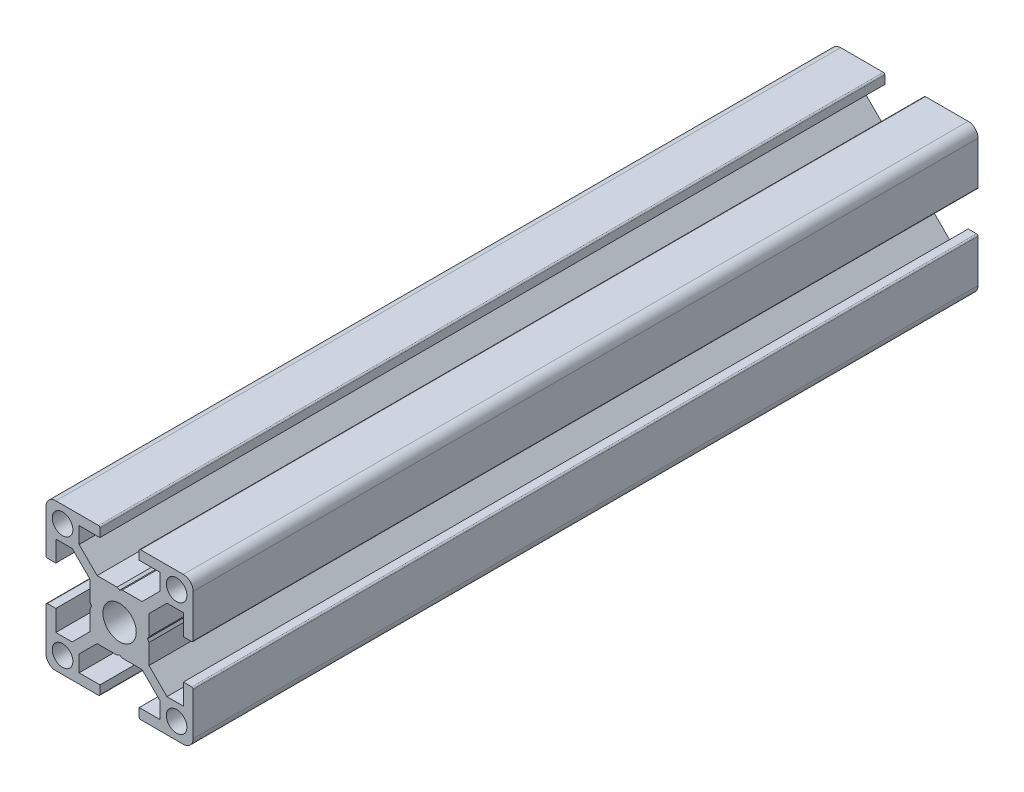
from build123d import *

# Parameters (mm, degrees)
SKETCH1_R           = 2.1
SKETCH1_R_2         = 3.4
BOSS_EXTRUDE1_DEPTH = 160


with BuildPart() as part:
    # Sketch1 → Boss-Extrude1 (new body)
    with BuildSketch(Plane.XY):
        with BuildLine():
            Line((-14.7, 4), (-13, 4))
            Line((-13, 4), (-13, 8.25))
            Line((-13, 8.25), (-9.664213562, 8.25))
            Line((-9.664213562, 8.25), (-6, 4.585786438))
            Line((-6, 4.585786438), (-6, 0.519615242))
            Line((-6, 0.519615242), (-5.7, 0))
            Line((-5.7, 0), (-6, -0.519615242))
            Line((-6, -0.519615242), (-6, -4.585786438))
            Line((-6, -4.585786438), (-9.664213562, -8.25))
            Line((-9.664213562, -8.25), (-13, -8.25))
            Line((-13, -8.25), (-13, -4))
            Line((-13, -4), (-14.7, -4))
            ThreePointArc((-14.7, -4), (-14.912132034, -4.087867966), (-15, -4.3))
            Line((-15, -4.3), (-15, -13))
            ThreePointArc((-15, -13), (-14.414213562, -14.414213562), (-13, -15))
            Line((-13, -15), (-4.3, -15))
            ThreePointArc((-4.3, -15), (-4.087867966, -14.912132034), (-4, -14.7))
            Line((-4, -14.7), (-4, -13))
            Line((-4, -13), (-8.25, -13))
            Line((-8.25, -13), (-8.25, -9.664213562))
            Line((-8.25, -9.664213562), (-4.585786438, -6))
            Line((-4.585786438, -6), (-0.519615242, -6))
            Line((-0.519615242, -6), (0, -5.7))
            Line((0, -5.7), (0.519615242, -6))
            Line((0.519615242, -6), (4.585786438, -6))
            Line((4.585786438, -6), (8.25, -9.664213562))
            Line((8.25, -9.664213562), (8.25, -13))
            Line((8.25, -13), (4, -13))
            Line((4, -13), (4, -14.7))
            ThreePointArc((4, -14.7), (4.087867966, -14.912132034), (4.3, -15))
            Line((4.3, -15), (13, -15))
            ThreePointArc((13, -15), (14.414213562, -14.414213562), (15, -13))
            Line((15, -13), (15, -4.3))
            ThreePointArc((15, -4.3), (14.912132034, -4.087867966), (14.7, -4))
            Line((14.7, -4), (13, -4))
            Line((13, -4), (13, -8.25))
            Line((13, -8.25), (9.664213562, -8.25))
            Line((9.664213562, -8.25), (6, -4.585786438))
            Line((6, -4.585786438), (6, -0.519615242))
            Line((6, -0.519615242), (5.7, 0))
            Line((5.7, 0), (6, 0.519615242))
            Line((6, 0.519615242), (6, 4.585786438))
            Line((6, 4.585786438), (9.664213562, 8.25))
            Line((9.664213562, 8.25), (13, 8.25))
            Line((13, 8.25), (13, 4))
            Line((13, 4), (14.7, 4))
            ThreePointArc((14.7, 4), (14.912132034, 4.087867966), (15, 4.3))
            Line((15, 4.3), (15, 13))
            ThreePointArc((15, 13), (14.414213562, 14.414213562), (13, 15))
            Line((13, 15), (4.3, 15))
            ThreePointArc((4.3, 15), (4.087867966, 14.912132034), (4, 14.7))
            Line((4, 14.7), (4, 13))
            Line((4, 13), (8.25, 13))
            Line((8.25, 13), (8.25, 9.664213562))
            Line((8.25, 9.664213562), (4.585786438, 6))
            Line((4.585786438, 6), (0.519615242, 6))
            Line((0.519615242, 6), (0, 5.7))
            Line((0, 5.7), (-0.519615242, 6))
            Line((-0.519615242, 6), (-4.585786438, 6))
            Line((-4.585786438, 6), (-8.25, 9.664213562))
            Line((-8.25, 9.664213562), (-8.25, 13))
            Line((-8.25, 13), (-4, 13))
            Line((-4, 13), (-4, 14.7))
            ThreePointArc((-4, 14.7), (-4.087867966, 14.912132034), (-4.3, 15))
            Line((-4.3, 15), (-13, 15))
            ThreePointArc((-13, 15), (-14.414213562, 14.414213562), (-15, 13))
            Line((-15, 13), (-15, 4.3))
            ThreePointArc((-15, 4.3), (-14.912132034, 4.087867966), (-14.7, 4))
        make_face()
        with Locations((11.625, 11.625)):
            Circle(SKETCH1_R, mode=Mode.SUBTRACT)
        with Locations((11.625, -11.625)):
            Circle(SKETCH1_R, mode=Mode.SUBTRACT)
        Circle(SKETCH1_R_2, mode=Mode.SUBTRACT)
        with Locations((-11.625, -11.625)):
            Circle(SKETCH1_R, mode=Mode.SUBTRACT)
        with Locations((-11.625, 11.625)):
            Circle(SKETCH1_R, mode=Mode.SUBTRACT)
    extrude(amount=BOSS_EXTRUDE1_DEPTH)


solid = part.part
